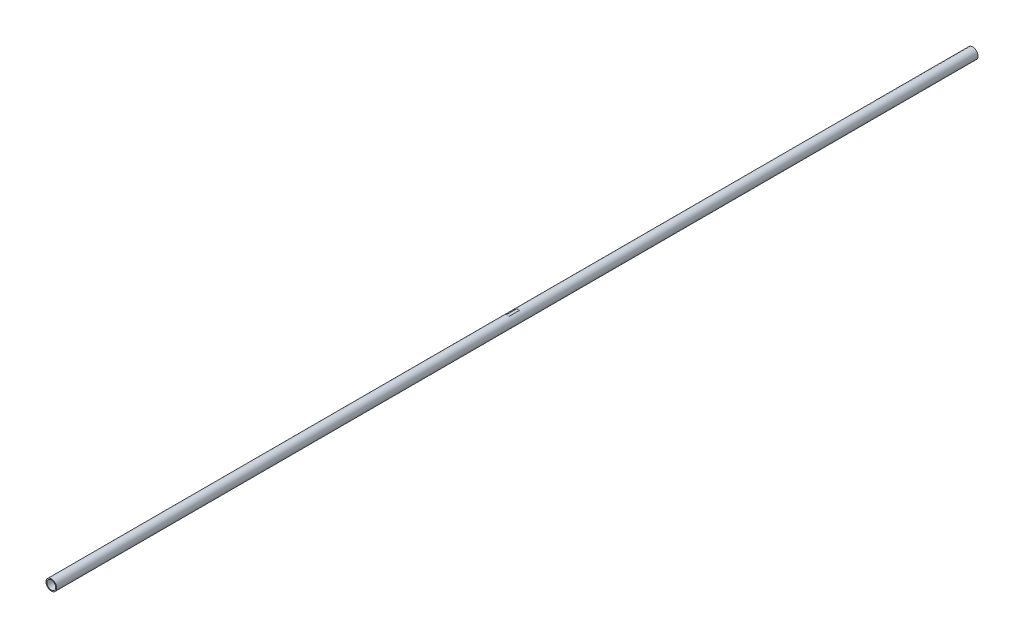
from build123d import *

# Parameters (mm, degrees)
SKETCH1_R               = 21.082
SKETCH1_R_2             = 17.526
BOSS_EXTRUDE1_DEPTH     = 3657.6
CUT_EXTRUDE1_DEPTH      = 3658.721512287
CUT_EXTRUDE1_DEPTH_BACK = 3658.721512287
SKETCH4_W               = 41.647807864
SKETCH4_H               = 5.7730783


with BuildPart() as part:
    # Sketch1 → Boss-Extrude1 (new body)
    with BuildSketch(Plane.XY):
        with Locations(Location((0, 0, 0), (0, 0, 180))):
            Circle(SKETCH1_R)
        with Locations(Location((0, 0, 0), (0, 0, 180))):
            Circle(SKETCH1_R_2, mode=Mode.SUBTRACT)
    extrude(amount=BOSS_EXTRUDE1_DEPTH)

    # Sketch4 → Cut-Extrude1 (cut, two sides: drawn at the far end of the back side and taken through both)
    with BuildSketch(Plane(origin=(0, 0, 0), x_dir=(0, 0, -1), z_dir=(1, 0, 0)).offset(-CUT_EXTRUDE1_DEPTH_BACK)):
        with Locations((-1825.339738044, 23.218596963)):
            Rectangle(SKETCH4_W, SKETCH4_H)
    extrude(amount=CUT_EXTRUDE1_DEPTH + CUT_EXTRUDE1_DEPTH_BACK, mode=Mode.SUBTRACT)


solid = part.part
